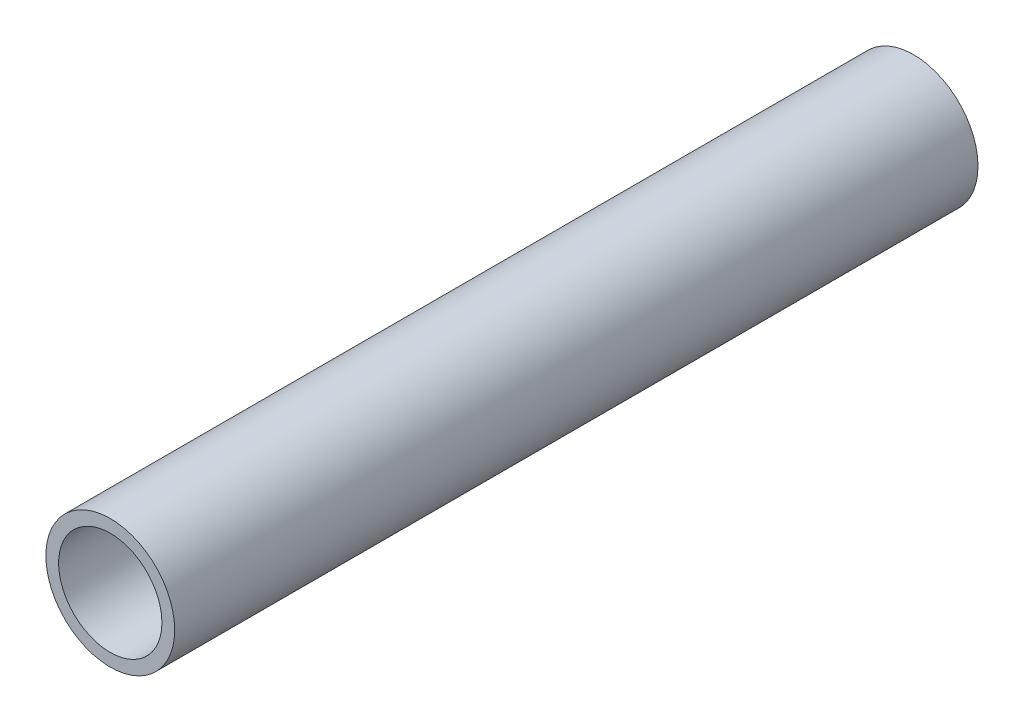
from build123d import *

# Parameters (mm, degrees)
SKETCH1_R           = 5.05
SKETCH1_R_2         = 4.05
EXTRUDE_THIN1_DEPTH = 63


with BuildPart() as part:
    # Sketch1 → Extrude-Thin1 (new body)
    with BuildSketch(Plane.XY):
        Circle(SKETCH1_R)
        Circle(SKETCH1_R_2, mode=Mode.SUBTRACT)
    extrude(amount=EXTRUDE_THIN1_DEPTH)


solid = part.part
